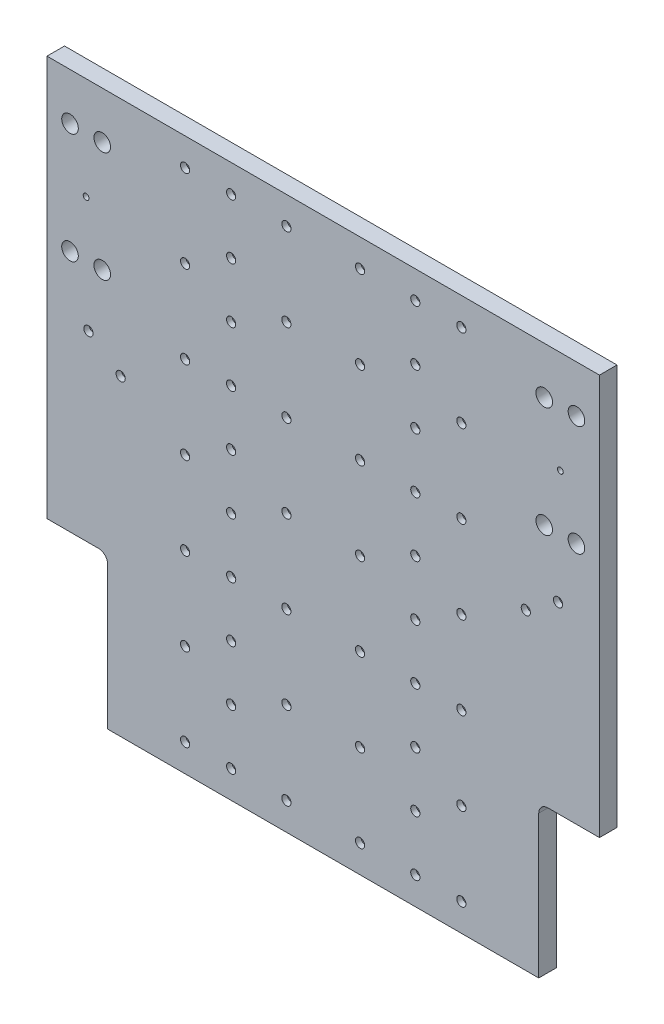
from build123d import *

# Parameters (mm, degrees)
SKETCH1_W                      = 600
SKETCH1_H                      = 600
BOSS_EXTRUDE1_DEPTH            = 19.05
SKETCH2_W                      = 65.95
SKETCH2_H                      = 165
CUT_EXTRUDE1_DEPTH             = 425.69153806
FILLET1_R                      = 10
SKETCH5_R                      = 9.017
SKETCH5_R_2                    = 3.175
CUT_EXTRUDE2_DEPTH             = 425.69153806
CBORE_FOR_M5_SHCS1_D           = 5.5
CBORE_FOR_M5_SHCS1_DEPTH       = 28.347633298
CBORE_FOR_M5_SHCS1_CBORE_D     = 10
CBORE_FOR_M5_SHCS1_CBORE_DEPTH = 6
CBORE_FOR_M5_SHCS1_TIP         = 1.652366702


with BuildPart() as part:
    # Sketch1 → Boss-Extrude1 (new body)
    with BuildSketch(Plane.XY):
        Rectangle(SKETCH1_W, SKETCH1_H)
    extrude(amount=BOSS_EXTRUDE1_DEPTH)

    # Sketch2 → Cut-Extrude1 (cut, through all)
    with BuildSketch(Plane(origin=(0, 0, 0), x_dir=(-1, 0, 0), z_dir=(0, 0, -1))):
        with Locations((267.025, -217.5)):
            Rectangle(SKETCH2_W, SKETCH2_H)
        with Locations((-267.025, -217.5)):
            Rectangle(SKETCH2_W, SKETCH2_H)
    extrude(amount=-CUT_EXTRUDE1_DEPTH, mode=Mode.SUBTRACT)

    # Fillet1
    fillet1_edges = [part.edges().sort_by_distance(p)[0] for p in [
        (-234.05, -135, 9.525),
        (234.05, -135, 9.525),
    ]]
    fillet(fillet1_edges, radius=FILLET1_R)

    # Sketch5 → Cut-Extrude2 (cut, through all)
    with BuildSketch(Plane(origin=(0, 0, 0), x_dir=(-1, 0, 0), z_dir=(0, 0, -1))):
        with Locations((240, 249)):
            Circle(SKETCH5_R)
        with Locations((275, 249)):
            Circle(SKETCH5_R)
        with Locations((257.5, 189)):
            Circle(SKETCH5_R_2)
        with Locations((275, 129)):
            Circle(SKETCH5_R)
        with Locations((240, 129)):
            Circle(SKETCH5_R)
        with Locations((-275, 129)):
            Circle(SKETCH5_R)
        with Locations((-240, 129)):
            Circle(SKETCH5_R)
        with Locations((-257.5, 189)):
            Circle(SKETCH5_R_2)
        with Locations((-275, 249)):
            Circle(SKETCH5_R)
        with Locations((-240, 249)):
            Circle(SKETCH5_R)
    extrude(amount=-CUT_EXTRUDE2_DEPTH, mode=Mode.SUBTRACT)

    # CBORE for M5 SHCS1
    with Locations(Plane.XY.offset(19.05)):
        with Locations((-100, 210), (-100, 270), (100, 270), (100, 210), (100, 150), (-100, 150), (-100, 90), (100, 90), (100, 30), (-100, 30), (-255, 64), (-220, 39), (255, 64), (220, 39), (100, -30), (-100, -30), (-100, -90), (100, -90), (100, -150), (-100, -150), (-100, -210), (100, -210), (100, -270), (-100, -270), (150, -270), (150, -180), (150, -90), (150, 0), (150, 90), (150, 180), (150, 270), (40, 270), (40, 180), (-40, 180), (-40, 270), (-150, 270), (-150, 180), (-150, 90), (-40, 90), (40, 90), (40, 0), (-40, 0), (-40, -90), (40, -90), (-150, -90), (-150, 0), (-150, -180), (-150, -270), (-40, -270), (-40, -180), (40, -180), (40, -270)):
            CounterBoreHole(CBORE_FOR_M5_SHCS1_D / 2, CBORE_FOR_M5_SHCS1_CBORE_D / 2, CBORE_FOR_M5_SHCS1_CBORE_DEPTH, depth=CBORE_FOR_M5_SHCS1_DEPTH)
            with Locations((0, 0, -(CBORE_FOR_M5_SHCS1_DEPTH + CBORE_FOR_M5_SHCS1_TIP / 2))):  # 118° drill point
                Cone(0, CBORE_FOR_M5_SHCS1_D / 2, CBORE_FOR_M5_SHCS1_TIP, mode=Mode.SUBTRACT)


solid = part.part
